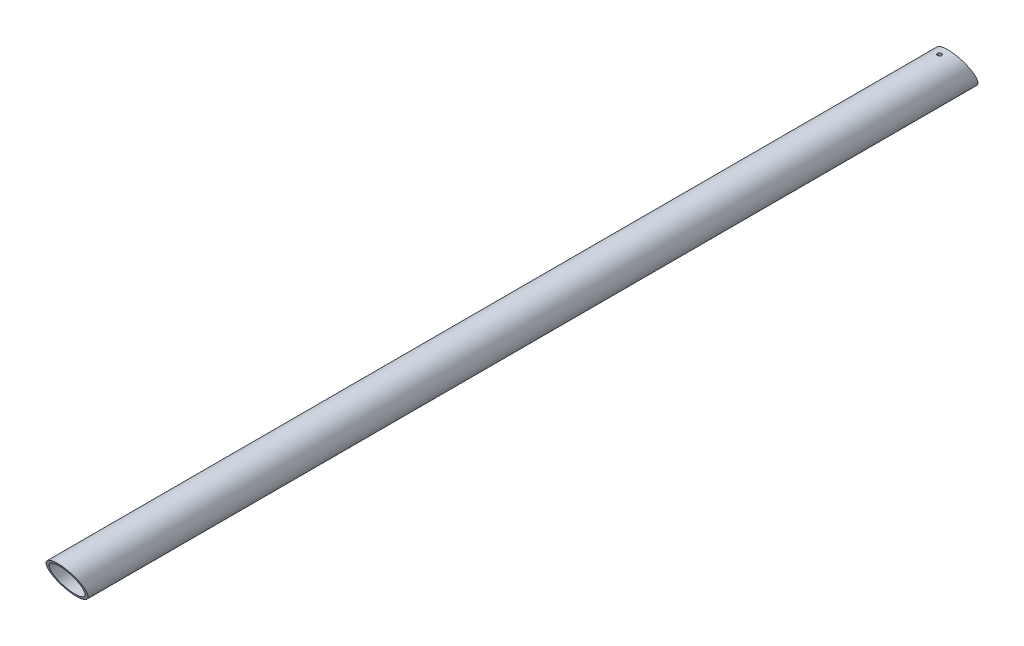
from build123d import *

# Parameters (mm, degrees)
SKETCH1_R          = 36.5125
SKETCH1_R_2        = 31.3563
BASE_EXTRUDE_DEPTH = 914.4
CUT_EXTRUDE5_DEPTH = 76.2
SKETCH4_R          = 3.9751
CUT_EXTRUDE2_DEPTH = 63.5
SKETCH5_R          = 3.9751
CUT_EXTRUDE3_DEPTH = 881.900721082


with BuildPart() as part:
    # Sketch1 → Base-Extrude (new, symmetric)
    with BuildSketch(Plane.XY):
        Circle(SKETCH1_R)
        Circle(SKETCH1_R_2, mode=Mode.SUBTRACT)
    extrude(amount=BASE_EXTRUDE_DEPTH, both=True)

    # Sketch6 → Cut-Extrude5 (cut, symmetric)
    with BuildSketch(Plane(origin=(0, 0, 0), x_dir=(0, 0, -1), z_dir=(1, 0, 0))):
        Polygon((-956.15258377, 192.708539462), (-746.964120429, -232.924753088), (-956.15258377, -232.924753088), align=None)
        Polygon((766.72941623, 192.708539462), (975.917879571, -232.924753088), (975.917879571, 192.708539462), align=None)
    extrude(amount=CUT_EXTRUDE5_DEPTH, both=True, mode=Mode.SUBTRACT)

    # Sketch4 → Cut-Extrude2 (cut, symmetric)
    with BuildSketch(Plane(origin=(0, 0, 0), x_dir=(1, 0, 0), z_dir=(0, 1, 0))):
        with Locations((0, 863.6)):
            Circle(SKETCH4_R)
    extrude(amount=CUT_EXTRUDE2_DEPTH, both=True, mode=Mode.SUBTRACT)

    # Sketch5 → Cut-Extrude3 (cut, through all)
    with BuildSketch(Plane(origin=(0, 0, 0), x_dir=(1, 0, 0), z_dir=(0, 1, 0))):
        with Locations((0, 827.62098982)):
            Circle(SKETCH5_R)
    extrude(amount=CUT_EXTRUDE3_DEPTH, mode=Mode.SUBTRACT)


solid = part.part
